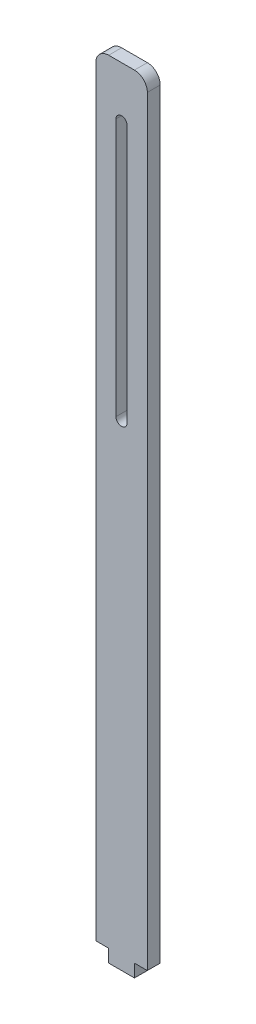
from build123d import *

# Parameters (mm, degrees)
BOSS_EXTRU_1_DEPTH      = 6.35
ENL_V_MAT_EXTRU_2_DEPTH = 198.361432403
CONG_1_R                = 6.35


with BuildPart() as part:
    # Esquisse2 → Boss.-Extru.1 (new body)
    with BuildSketch(Plane.XY):
        Polygon((6.35, -190.5), (12.7, -190.5), (12.7, 190.5), (-12.7, 190.5), (-12.7, -190.5), (-6.35, -190.5), (-6.35, -196.85), (6.35, -196.85), align=None)
    extrude(amount=BOSS_EXTRU_1_DEPTH)

    # Esquisse4 → Enlèv. mat.-Extru.2 (cut, through all)
    with BuildSketch(Plane.XY.offset(6.35)):
        with BuildLine():
            Line((2.75, 165.1), (2.75, 38.1))
            ThreePointArc((2.75, 38.1), (0, 35.35), (-2.75, 38.1))
            Line((-2.75, 38.1), (-2.75, 165.1))
            ThreePointArc((-2.75, 165.1), (0, 167.85), (2.75, 165.1))
        make_face()
    extrude(amount=-ENL_V_MAT_EXTRU_2_DEPTH, mode=Mode.SUBTRACT)

    # Congé1
    cong_1_edges = [part.edges().sort_by_distance(p)[0] for p in [
        (-12.7, 190.5, 3.175),
        (12.7, 190.5, 3.175),
    ]]
    fillet(cong_1_edges, radius=CONG_1_R)


solid = part.part
